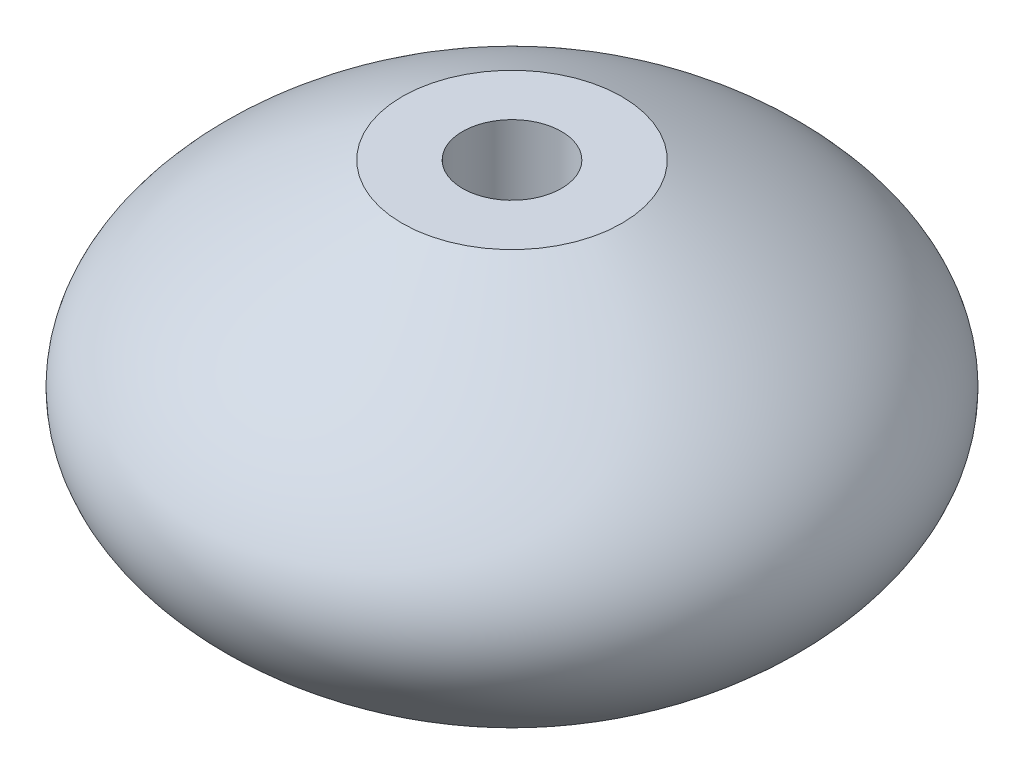
from build123d import *

# Parameters (mm, degrees)
SKETCH_2_R          = 2.25
CUT_EXTRUDE_1_DEPTH = 28.756260728


with BuildPart() as part:
    # 草图1 → 旋转1 (revolve)
    with BuildSketch(Plane.XY):
        with BuildLine():
            Line((5, 8.95), (0, 8.95))
            Line((0, 8.95), (0, 0))
            Line((0, 0), (0, -8.95))
            Line((0, -8.95), (5, -8.95))
            add(Edge.make_bspline(
                [(5, 8.95), (25, 0), (5, -8.95)],
                knots=[0, 0, 0, 1, 1, 1], degree=2))
        make_face()
    revolve(axis=Axis((0, 8.95, 0), (0, -1, 0)))

    # 草图2 → 切除-拉伸1 (cut, through all)
    with BuildSketch(Plane(origin=(0, 8.95, 0), x_dir=(1, 0, 0), z_dir=(0, 1, 0))):
        with Locations(Location((0, 0, 0), (0, 0, 270))):
            Circle(SKETCH_2_R)
    extrude(amount=-CUT_EXTRUDE_1_DEPTH, mode=Mode.SUBTRACT)


solid = part.part
